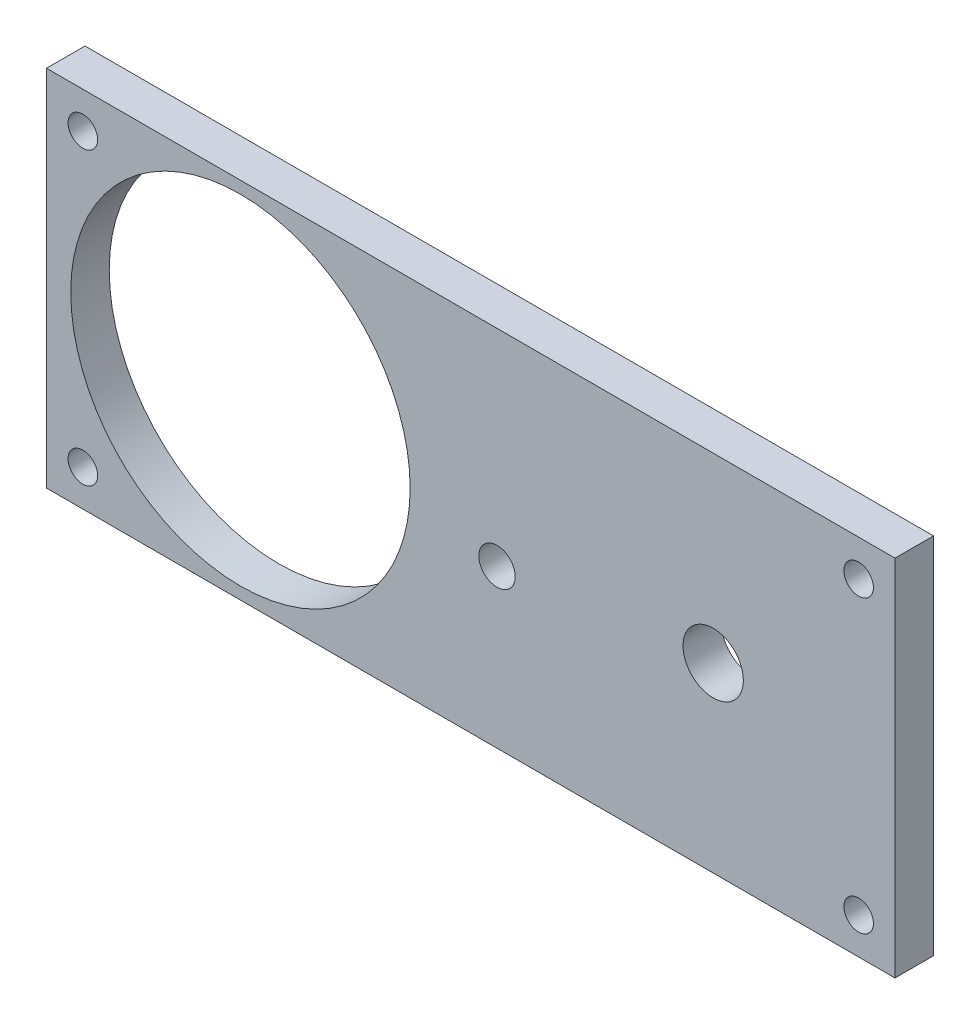
from build123d import *

# Parameters (mm, degrees)
SKETCH1_W             = 70
SKETCH1_H             = 30
SKETCH1_R             = 2.4892
SKETCH1_R_2           = 1.4986
SKETCH1_R_3           = 14
BOSS_EXTRUDE2_DEPTH   = 3.175
F_2_CLEARANCE_HOLE1_D = 2.4384


with BuildPart() as part:
    # Sketch1 → Boss-Extrude2 (new body)
    with BuildSketch(Plane.XY):
        with Locations((35, 15)):
            Rectangle(SKETCH1_W, SKETCH1_H)
        with Locations((55, 15)):
            Circle(SKETCH1_R, mode=Mode.SUBTRACT)
        with Locations((37.166699296, 13)):
            Circle(SKETCH1_R_2, mode=Mode.SUBTRACT)
        with Locations((16, 15)):
            Circle(SKETCH1_R_3, mode=Mode.SUBTRACT)
    extrude(amount=BOSS_EXTRUDE2_DEPTH)

    # #2 Clearance Hole1 (through all)
    with Locations(Plane.XY.offset(3.175)):
        with Locations((67, 3), (67, 27), (3, 27), (3, 3)):
            Hole(F_2_CLEARANCE_HOLE1_D / 2)


solid = part.part
